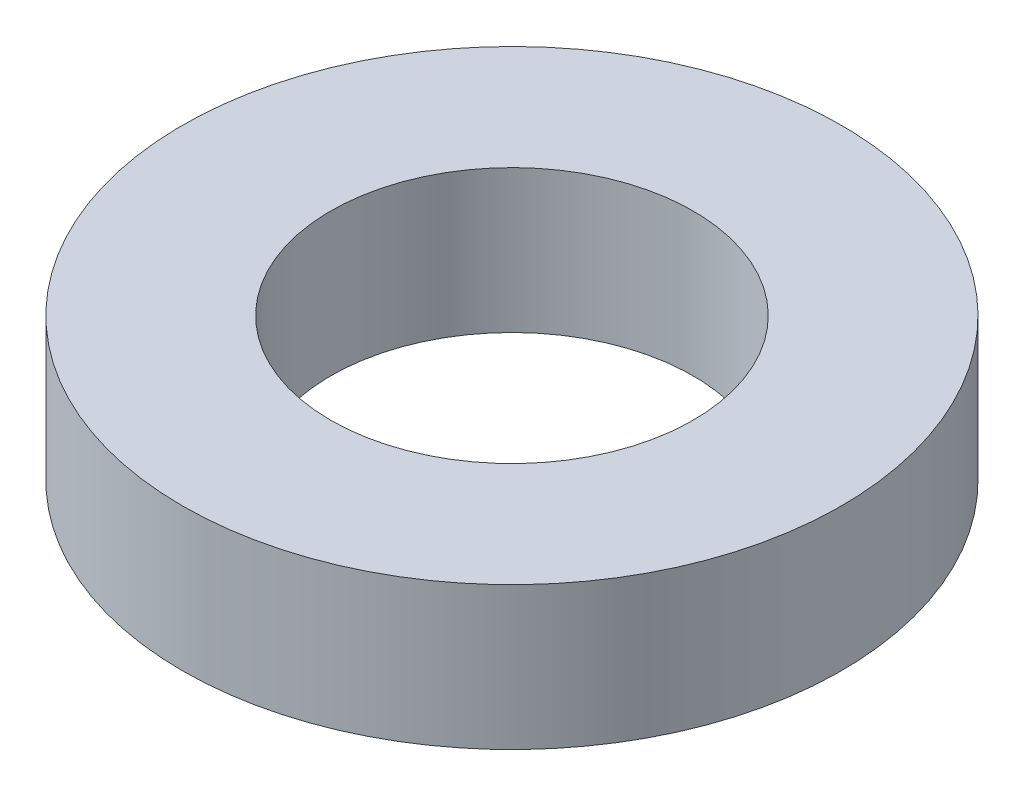
from build123d import *

# Parameters (mm, degrees)
SKETCH1_R           = 3
SKETCH1_R_2         = 1.65
BOSS_EXTRUDE1_DEPTH = 1.3


with BuildPart() as part:
    # Sketch1 → Boss-Extrude1 (new body)
    with BuildSketch(Plane(origin=(0, 0, 0), x_dir=(1, 0, 0), z_dir=(0, 1, 0))):
        with Locations(Location((0, 0, 0), (0, 0, 270))):
            Circle(SKETCH1_R)
        with Locations(Location((0, 0, 0), (0, 0, 270))):
            Circle(SKETCH1_R_2, mode=Mode.SUBTRACT)
    extrude(amount=BOSS_EXTRUDE1_DEPTH)


solid = part.part
